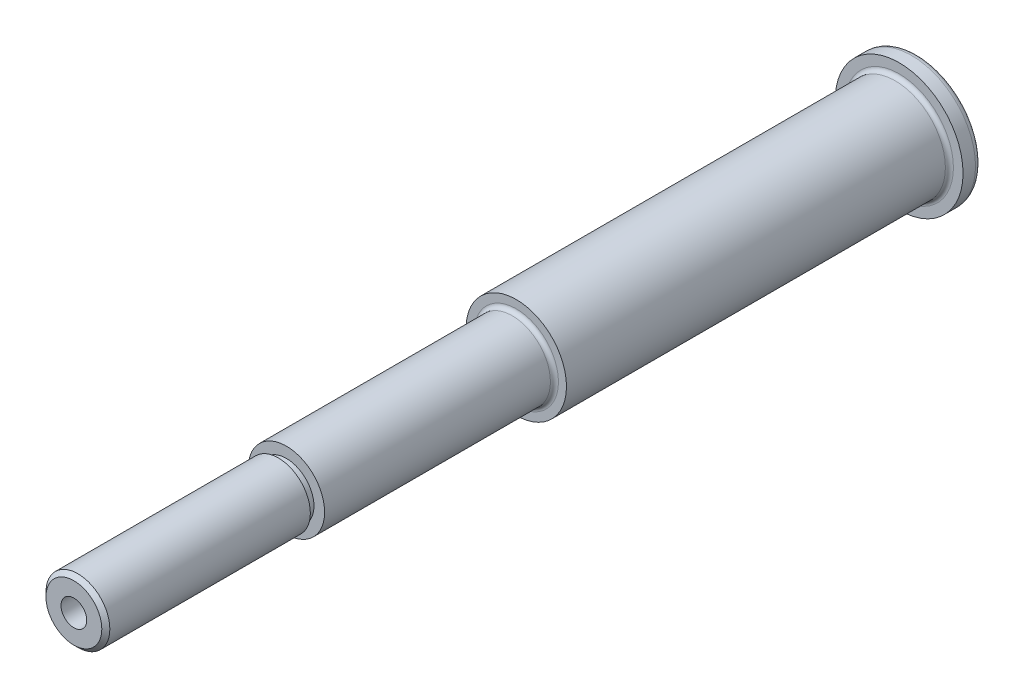
from build123d import *

# Parameters (mm, degrees)
SKETCH3_R          = 3.2
CUT_EXTRUDE1_DEPTH = 35


with BuildPart() as part:
    # Sketch2 → Base-Revolve (revolve)
    with BuildSketch(Plane(origin=(0, 0, 0), x_dir=(0, 0, -1), z_dir=(1, 0, 0)), mode=Mode.PRIVATE) as base_revolve_sk:
        with BuildLine():
            Line((0, 0), (0, 14.4))
            ThreePointArc((0, 14.4), (-0.439339828, 15.460660172), (-1.5, 15.9))
            Line((-1.5, 15.9), (-4.6, 15.9))
            Line((-4.6, 15.9), (-4.6, 13.5))
            ThreePointArc((-4.6, 13.5), (-4.892893219, 12.792893219), (-5.6, 12.5))
            Line((-5.6, 12.5), (-99.9, 12.5))
            Line((-99.9, 12.5), (-99.9, 10.5))
            ThreePointArc((-99.9, 10.5), (-100.192893219, 9.792893219), (-100.9, 9.5))
            Line((-100.9, 9.5), (-157.1, 9.5))
            Line((-157.1, 9.5), (-157.1, 6.85))
            Line((-157.1, 6.85), (-159.1, 6.85))
            Line((-159.1, 6.85), (-159.1, 7.95))
            Line((-159.1, 7.95), (-209, 7.95))
            Line((-209, 7.95), (-210, 6.95))
            Line((-210, 6.95), (-210, 0))
            Line((-210, 0), (0, 0))
        make_face()
    revolve(base_revolve_sk.sketch.rotate(Axis((0, 0, 0), (0, 0, -1)), 90), axis=Axis((0, 0, 0), (0, 0, -1)))

    # Sketch3 → Cut-Extrude1 (cut)
    with BuildSketch(Plane.XY.offset(210)):
        Circle(SKETCH3_R)
    extrude(amount=-CUT_EXTRUDE1_DEPTH, mode=Mode.SUBTRACT)


solid = part.part
